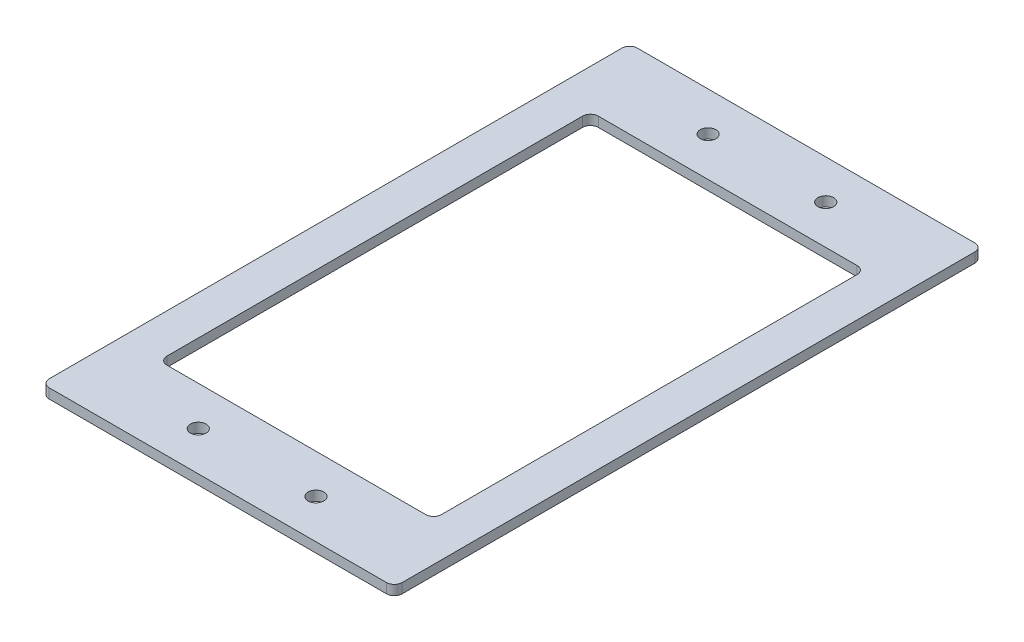
from build123d import *

# Parameters (mm, degrees)
SKETCH1_W           = 114.3
SKETCH1_H           = 190.5
SKETCH1_W_2         = 88.9
SKETCH1_H_2         = 139.7
BOSS_EXTRUDE1_DEPTH = 3.175
SKETCH2_R           = 2.54
CUT_EXTRUDE1_DEPTH  = 4.7625
FILLET1_R           = 2.54
FILLET2_R           = 2.54


with BuildPart() as part:
    # Sketch1 → Boss-Extrude1 (new body)
    with BuildSketch(Plane(origin=(0, 0, 0), x_dir=(1, 0, 0), z_dir=(0, 1, 0))):
        Rectangle(SKETCH1_W, SKETCH1_H)
        Rectangle(SKETCH1_W_2, SKETCH1_H_2, mode=Mode.SUBTRACT)
    extrude(amount=BOSS_EXTRUDE1_DEPTH)

    # Sketch2 → Cut-Extrude1 (cut)
    with BuildSketch(Plane(origin=(0, 3.175, 0), x_dir=(1, 0, 0), z_dir=(0, 1, 0))):
        with Locations(Location((19.05, -82.55, 0), (0, 0, 270))):
            Circle(SKETCH2_R)
        with Locations(Location((19.05, 82.55, 0), (0, 0, 270))):
            Circle(SKETCH2_R)
        with Locations(Location((-19.05, -82.55, 0), (0, 0, 270))):
            Circle(SKETCH2_R)
        with Locations(Location((-19.05, 82.55, 0), (0, 0, 270))):
            Circle(SKETCH2_R)
    extrude(amount=-CUT_EXTRUDE1_DEPTH, mode=Mode.SUBTRACT)

    # Fillet1
    fillet1_edges = [part.edges().sort_by_distance(p)[0] for p in [
        (-44.45, 1.5875, -69.85),
        (-44.45, 1.5875, 69.85),
        (44.45, 1.5875, 69.85),
        (44.45, 1.5875, -69.85),
    ]]
    fillet(fillet1_edges, radius=FILLET1_R)

    # Fillet2
    fillet2_edges = [part.edges().sort_by_distance(p)[0] for p in [
        (-57.15, 1.5875, -95.25),
        (57.15, 1.5875, -95.25),
        (57.15, 1.5875, 95.25),
        (-57.15, 1.5875, 95.25),
    ]]
    fillet(fillet2_edges, radius=FILLET2_R)


solid = part.part
